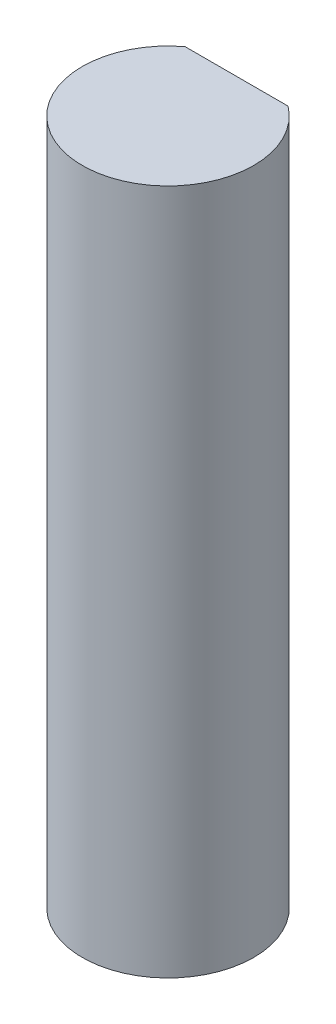
from build123d import *

# Parameters (mm, degrees)
SKETCH1_R           = 3.175
BOSS_EXTRUDE1_DEPTH = 25.4
CUT_EXTRUDE1_DEPTH  = 26.793821935


with BuildPart() as part:
    # Sketch1 → Boss-Extrude1 (new body)
    with BuildSketch(Plane(origin=(0, 0, 0), x_dir=(1, 0, 0), z_dir=(0, 1, 0))):
        with Locations(Location((0, 0, 0), (0, 0, 270))):
            Circle(SKETCH1_R)
    extrude(amount=BOSS_EXTRUDE1_DEPTH)

    # Sketch2 → Cut-Extrude1 (cut, through all)
    with BuildSketch(Plane.XZ):
        with BuildLine():
            Line((1.905, -2.54), (-1.905, -2.54))
            ThreePointArc((-1.905, -2.54), (0, -3.175), (1.905, -2.54))
        make_face()
    extrude(amount=-CUT_EXTRUDE1_DEPTH, mode=Mode.SUBTRACT)


solid = part.part
